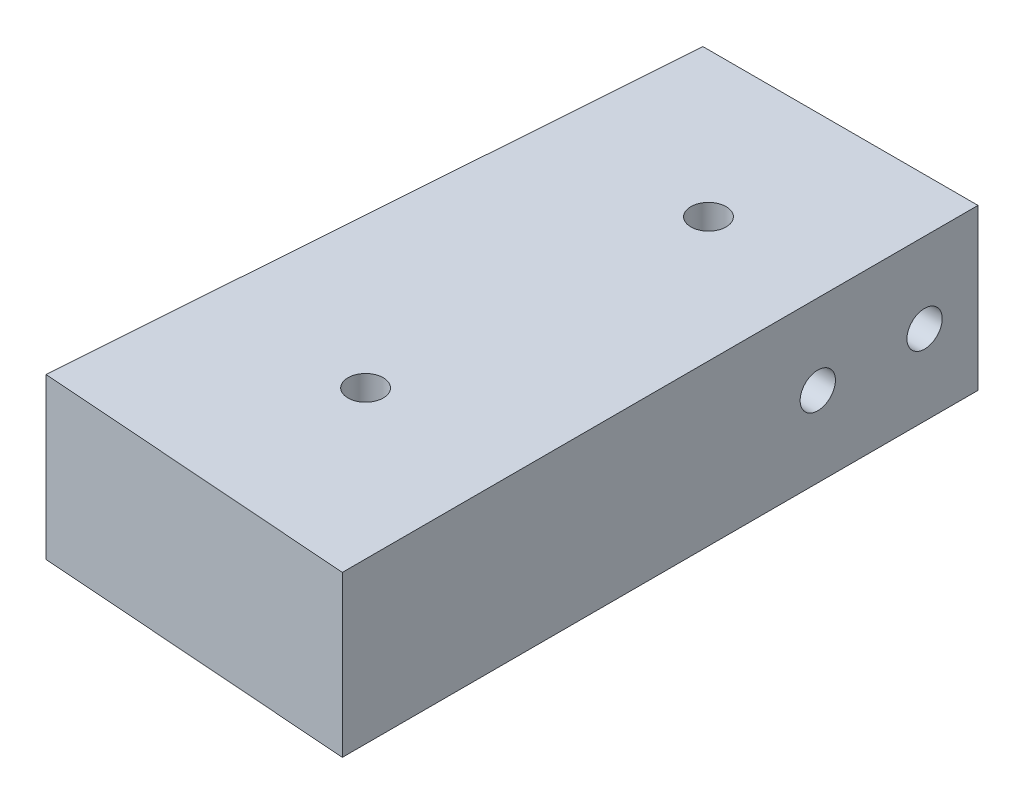
from build123d import *

# Parameters (mm, degrees)
EXTRUDE_1_DEPTH     = 15
SKETCH_2_R          = 1.45
CUT_EXTRUDE_1_DEPTH = 683.763824452
SKETCH_3_R          = 1.45
CUT_EXTRUDE_2_DEPTH = 69.276600135
SKETCH_4_R          = 1.65
CUT_EXTRUDE_3_DEPTH = 683.763824553
SKETCH_5_R          = 1.65
CUT_EXTRUDE_4_DEPTH = 69.276600157


with BuildPart() as part:
    # 草图1 → 凸台-拉伸1 (new body)
    with BuildSketch(Plane(origin=(0, 0, 0), x_dir=(1, 0, 0), z_dir=(0, 1, 0))):
        Polygon((654.253441162, 0), (650.079202112, -57.331500941), (680, -59.50999899), (680, 0), align=None)
    extrude(amount=EXTRUDE_1_DEPTH)

    # 草图2 → 切除-拉伸1 (cut, through all)
    with BuildSketch(Plane.XZ):
        with Locations(Location((668.307348129, 13.539553134, 0), (0, 0, 270))):
            Circle(SKETCH_2_R)
        with Locations(Location((666.12885008, 43.460351022, 0), (0, 0, 270))):
            Circle(SKETCH_2_R)
    extrude(amount=-CUT_EXTRUDE_1_DEPTH, mode=Mode.SUBTRACT)

    # 草图3 → 切除-拉伸2 (cut, through all)
    with BuildSketch(Plane(origin=(680, 0, 0), x_dir=(0, 0, -1), z_dir=(1, 0, 0))):
        with Locations((-15, 7.5)):
            Circle(SKETCH_3_R)
        with Locations((-5, 7.5)):
            Circle(SKETCH_3_R)
    extrude(amount=-CUT_EXTRUDE_2_DEPTH, mode=Mode.SUBTRACT)

    # 草图4 → 切除-拉伸3 (cut, through all)
    with BuildSketch(Plane(origin=(0, 15, 0), x_dir=(1, 0, 0), z_dir=(0, 1, 0))):
        with Locations(Location((668.307348129, -13.539553134, 0), (0, 0, 270))):
            Circle(SKETCH_4_R)
        with Locations(Location((666.12885008, -43.460351022, 0), (0, 0, 270))):
            Circle(SKETCH_4_R)
    extrude(amount=-CUT_EXTRUDE_3_DEPTH, mode=Mode.SUBTRACT)

    # 草图5 → 切除-拉伸4 (cut, through all)
    with BuildSketch(Plane(origin=(680, 0, 0), x_dir=(0, 0, -1), z_dir=(1, 0, 0))):
        with Locations((-15, 7.5)):
            Circle(SKETCH_5_R)
        with Locations((-5, 7.5)):
            Circle(SKETCH_5_R)
    extrude(amount=-CUT_EXTRUDE_4_DEPTH, mode=Mode.SUBTRACT)


solid = part.part
